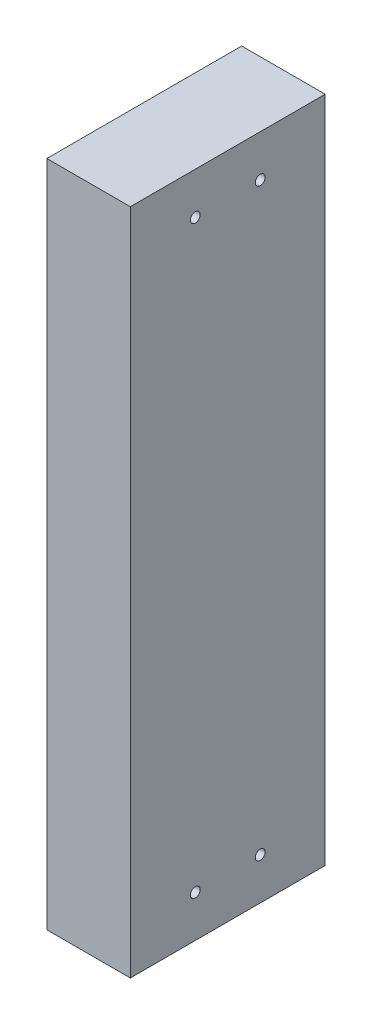
from build123d import *

# Parameters (mm, degrees)
SKETCH1_W           = 38.1
SKETCH1_H           = 88.9
BOSS_EXTRUDE1_DEPTH = 304.8
SKETCH2_R           = 2.2479
CUT_EXTRUDE1_DEPTH  = 320.777829125


with BuildPart() as part:
    # Sketch1 → Boss-Extrude1 (new body)
    with BuildSketch(Plane(origin=(0, 0, 0), x_dir=(1, 0, 0), z_dir=(0, 1, 0))):
        with Locations((19.05, 44.45)):
            Rectangle(SKETCH1_W, SKETCH1_H)
    extrude(amount=BOSS_EXTRUDE1_DEPTH)

    # Sketch2 → Cut-Extrude1 (cut, through all)
    with BuildSketch(Plane(origin=(38.1, 0, 0), x_dir=(0, 0, -1), z_dir=(1, 0, 0))):
        with Locations((59.266666667, 285.75)):
            Circle(SKETCH2_R)
        with Locations((59.266666667, 19.05)):
            Circle(SKETCH2_R)
        with Locations((29.633333333, 19.05)):
            Circle(SKETCH2_R)
        with Locations((29.633333333, 285.75)):
            Circle(SKETCH2_R)
    extrude(amount=-CUT_EXTRUDE1_DEPTH, mode=Mode.SUBTRACT)


solid = part.part
